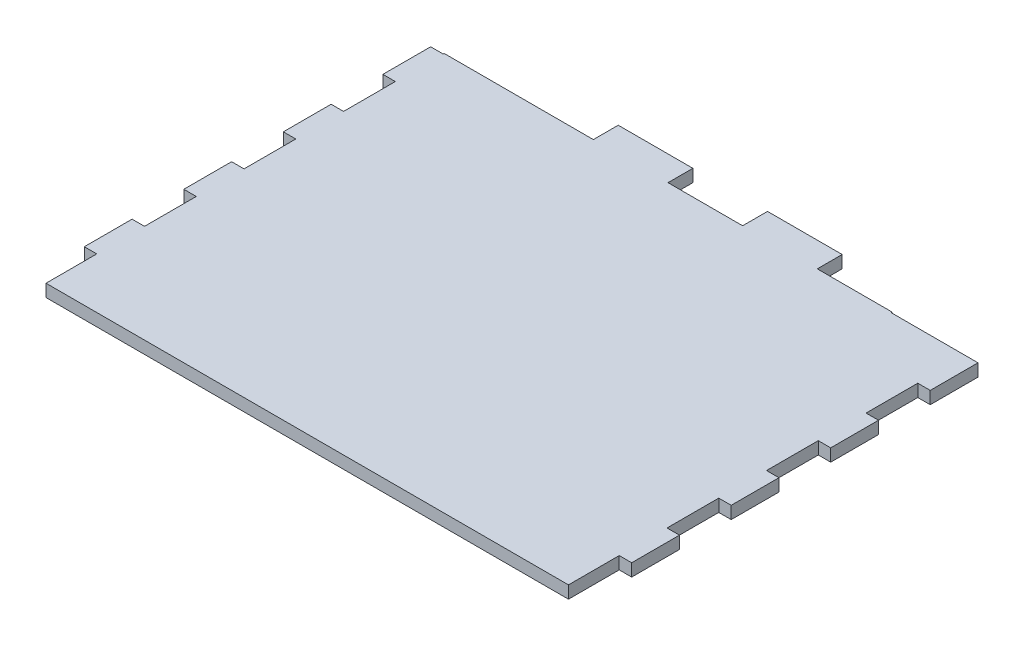
from build123d import *

# Parameters (mm, degrees)
SKETCH1_W           = 133.35
SKETCH1_H           = 101.6
BOSS_EXTRUDE1_DEPTH = 3.175
SKETCH2_W           = 3.175
SKETCH2_H           = 12.192
SKETCH2_W_2         = 19.05
SKETCH2_H_2         = 6.35
BOSS_EXTRUDE2_DEPTH = 3.175
SKETCH3_W           = 19.05
SKETCH3_H           = 6.35
SKETCH3_H_2         = 6.604
CUT_EXTRUDE1_DEPTH  = 91.306287849


with BuildPart() as part:
    # Sketch1 → Boss-Extrude1 (new body)
    with BuildSketch(Plane(origin=(0, 0, 0), x_dir=(1, 0, 0), z_dir=(0, 1, 0))):
        Rectangle(SKETCH1_W, SKETCH1_H)
    extrude(amount=BOSS_EXTRUDE1_DEPTH)

    # Sketch2 → Boss-Extrude2 (add)
    with BuildSketch(Plane(origin=(0, 0, 0), x_dir=(-1, 0, 0), z_dir=(0, -1, 0))):
        with Locations((68.2625, -31.75)):
            Rectangle(SKETCH2_W, SKETCH2_H)
        with Locations((68.2625, -6.35)):
            Rectangle(SKETCH2_W, SKETCH2_H)
        with Locations((68.2625, 19.05)):
            Rectangle(SKETCH2_W, SKETCH2_H)
        with Locations((68.2625, 44.45)):
            Rectangle(SKETCH2_W, SKETCH2_H)
        with Locations((-68.2625, 44.45)):
            Rectangle(SKETCH2_W, SKETCH2_H)
        with Locations((-68.2625, 19.05)):
            Rectangle(SKETCH2_W, SKETCH2_H)
        with Locations((-68.2625, -6.35)):
            Rectangle(SKETCH2_W, SKETCH2_H)
        with Locations((-68.2625, -31.75)):
            Rectangle(SKETCH2_W, SKETCH2_H)
        with Locations((19.05, 53.975)):
            Rectangle(SKETCH2_W_2, SKETCH2_H_2)
        with Locations((57.15, 53.975)):
            Rectangle(SKETCH2_W_2, SKETCH2_H_2)
        with Locations((-19.05, 53.975)):
            Rectangle(SKETCH2_W_2, SKETCH2_H_2)
        with Locations((-57.15, 53.975)):
            Rectangle(SKETCH2_W_2, SKETCH2_H_2)
    extrude(amount=-BOSS_EXTRUDE2_DEPTH)

    # Sketch3 → Cut-Extrude1 (cut, through all)
    with BuildSketch(Plane(origin=(0, 0, 0), x_dir=(1, 0, 0), z_dir=(0, 1, 0))):
        with Locations((-57.15, 53.975)):
            Rectangle(SKETCH3_W, SKETCH3_H)
        with Locations((57.15, 53.848)):
            Rectangle(SKETCH3_W, SKETCH3_H_2)
    extrude(amount=CUT_EXTRUDE1_DEPTH, mode=Mode.SUBTRACT)


solid = part.part
